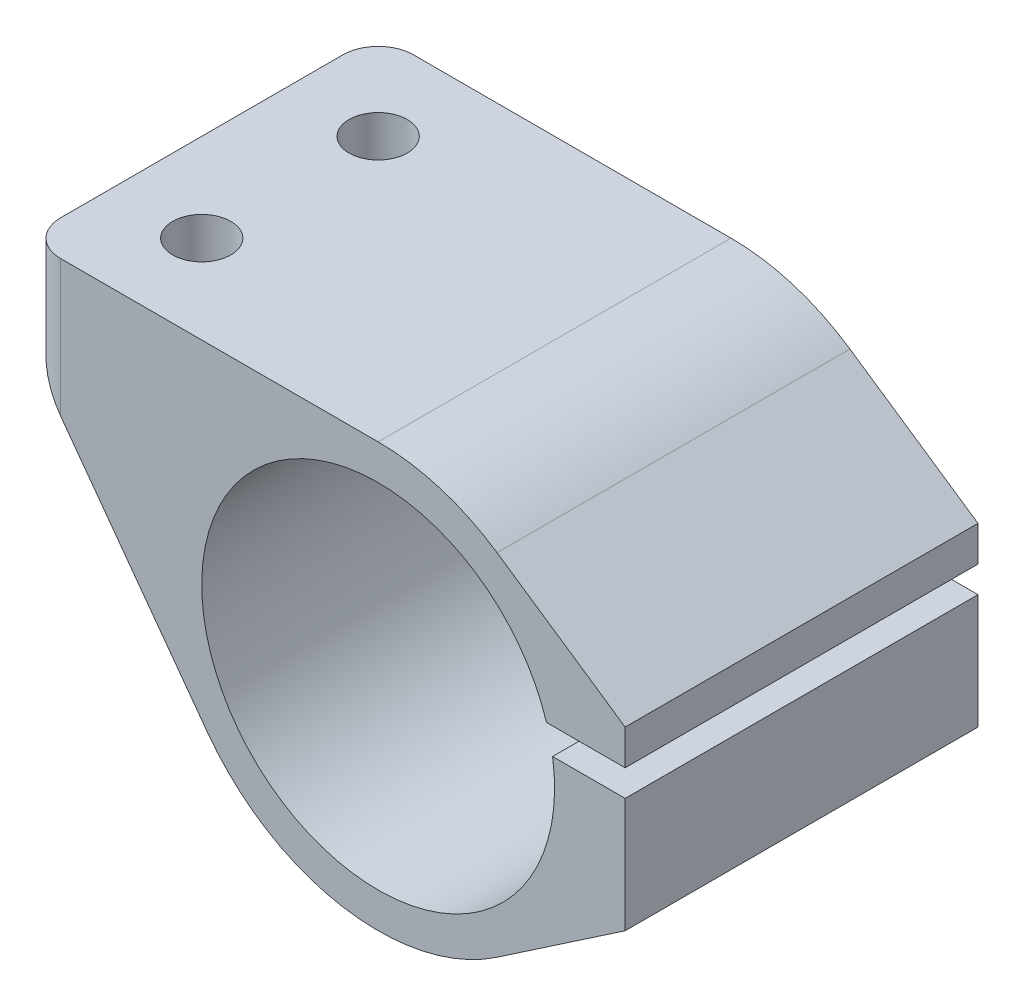
from build123d import *

# Parameters (mm, degrees)
BOSS_EXTRU_1_DEPTH      = 20
BOSS_EXTRU_2_START      = -20
BOSS_EXTRU_2_DEPTH      = 20
ESQUISSE3_R             = 1.65
ENL_V_MAT_EXTRU_1_DEPTH = 38.094473982
CONG_1_R                = 2


with BuildPart() as part:
    # Esquisse1 → Boss.-Extru.1 (new body)
    with BuildSketch(Plane.XY):
        with BuildLine():
            Line((6.739828673, -9.928479715), (14, -5))
            Line((14, -5), (14, 1.5))
            Line((14, 1.5), (9.886859967, 1.5))
            ThreePointArc((9.886859967, 1.5), (-9.742038622, -2.256697475), (9.539392014, 3))
            Line((9.539392014, 3), (14, 3))
            Line((14, 3), (14, 5))
            Line((14, 5), (6.739828673, 9.928479715))
            ThreePointArc((6.739828673, 9.928479715), (-12, 0), (6.739828673, -9.928479715))
        make_face()
    extrude(amount=BOSS_EXTRU_1_DEPTH)

    # Esquisse2 → Boss.-Extru.2 (add)
    with BuildSketch(Plane.XY.offset(20).offset(BOSS_EXTRU_2_START)):
        with BuildLine():
            Line((0, 12), (-20, 12))
            Line((-20, 12), (-20, 7))
            Line((-20, 7), (-9.681507645, -7.090021842))
            ThreePointArc((-9.681507645, -7.090021842), (-10.702342316, 5.427694625), (0, 12))
        make_face()
    extrude(amount=BOSS_EXTRU_2_DEPTH)

    # Esquisse3 → Enlèv. mat.-Extru.1 (cut, through all)
    with BuildSketch(Plane(origin=(0, 12, 0), x_dir=(1, 0, 0), z_dir=(0, 1, 0))):
        with Locations(Location((-15, -5, 0), (0, 0, 180))):
            Circle(ESQUISSE3_R)
        with Locations(Location((-15, -15, 0), (0, 0, 180))):
            Circle(ESQUISSE3_R)
    extrude(amount=-ENL_V_MAT_EXTRU_1_DEPTH, mode=Mode.SUBTRACT)

    # Congé1
    cong_1_edges = [part.edges().sort_by_distance(p)[0] for p in [
        (-20, 9.5, 0),
        (-20, 9.5, 20),
    ]]
    fillet(cong_1_edges, radius=CONG_1_R)


solid = part.part
